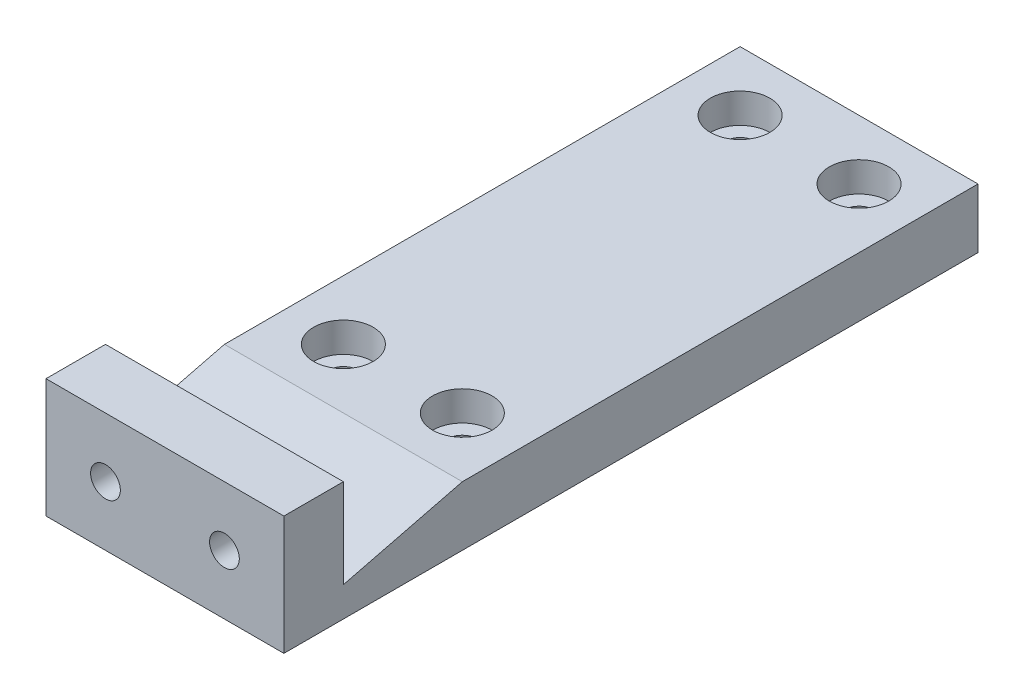
from build123d import *

# Parameters (mm, degrees)
SKETCH1_W               = 40
SKETCH1_H               = 116.7
BOSS_EXTRUDE1_DEPTH     = 10
SKETCH2_W               = 40
SKETCH2_H               = 10
BOSS_EXTRUDE2_DEPTH     = 10
CUT_EXTRUDE1_DEPTH      = 63.487778805
CUT_EXTRUDE1_DEPTH_BACK = 63.487778805
SKETCH3_R               = 2.5
SKETCH4_R               = 5
CUT_EXTRUDE2_DEPTH      = 5
CUT_EXTRUDE3_DEPTH      = 74.516817804
CUT_EXTRUDE3_DEPTH_BACK = 74.516817804
SKETCH6_R               = 2.5
CUT_EXTRUDE4_DEPTH      = 111.385189224
SKETCH7_R               = 5
CUT_EXTRUDE5_DEPTH      = 5


with BuildPart() as part:
    # Sketch1 → Boss-Extrude1 (new body)
    with BuildSketch(Plane(origin=(0, 0, 0), x_dir=(1, 0, 0), z_dir=(0, 1, 0))):
        Rectangle(SKETCH1_W, SKETCH1_H)
    extrude(amount=BOSS_EXTRUDE1_DEPTH)

    # Sketch2 → Boss-Extrude2 (add)
    with BuildSketch(Plane(origin=(0, 10, 0), x_dir=(1, 0, 0), z_dir=(0, 1, 0))):
        with Locations((0, -53.35)):
            Rectangle(SKETCH2_W, SKETCH2_H)
    extrude(amount=BOSS_EXTRUDE2_DEPTH)

    # Sketch3 → Cut-Extrude1 (cut, two sides: drawn at the far end of the back side and taken through both)
    with BuildSketch(Plane(origin=(0, 10, 0), x_dir=(1, 0, 0), z_dir=(0, 1, 0)).offset(-CUT_EXTRUDE1_DEPTH_BACK)):
        with Locations(Location((-10, 48.35, 0), (0, 0, 270))):
            Circle(SKETCH3_R)
        with Locations(Location((10, 48.35, 0), (0, 0, 270))):
            Circle(SKETCH3_R)
        with Locations(Location((10, -18.35, 0), (0, 0, 270))):
            Circle(SKETCH3_R)
        with Locations(Location((-10, -18.35, 0), (0, 0, 270))):
            Circle(SKETCH3_R)
    extrude(amount=CUT_EXTRUDE1_DEPTH + CUT_EXTRUDE1_DEPTH_BACK, mode=Mode.SUBTRACT)

    # Sketch4 → Cut-Extrude2 (cut)
    with BuildSketch(Plane(origin=(0, 10, 0), x_dir=(1, 0, 0), z_dir=(0, 1, 0))):
        with Locations(Location((10, 48.35, 0), (0, 0, 270))):
            Circle(SKETCH4_R)
        with Locations(Location((-10, 48.35, 0), (0, 0, 270))):
            Circle(SKETCH4_R)
        with Locations(Location((10, -18.35, 0), (0, 0, 270))):
            Circle(SKETCH4_R)
        with Locations(Location((-10, -18.35, 0), (0, 0, 270))):
            Circle(SKETCH4_R)
    extrude(amount=-CUT_EXTRUDE2_DEPTH, mode=Mode.SUBTRACT)

    # Sketch5 → Cut-Extrude3 (cut, two sides: drawn at the far end of the back side and taken through both)
    with BuildSketch(Plane.ZY.offset(20).offset(-CUT_EXTRUDE3_DEPTH_BACK)):
        Polygon((28.35, 10), (48.35, 5), (48.35, 10), align=None)
    extrude(amount=CUT_EXTRUDE3_DEPTH + CUT_EXTRUDE3_DEPTH_BACK, mode=Mode.SUBTRACT)

    # Sketch6 → Cut-Extrude4 (cut, through all)
    with BuildSketch(Plane(origin=(0, 0, 48.35), x_dir=(-1, 0, 0), z_dir=(0, 0, -1))):
        with Locations((-10, 10)):
            Circle(SKETCH6_R)
        with Locations((10, 10)):
            Circle(SKETCH6_R)
    extrude(amount=-CUT_EXTRUDE4_DEPTH, mode=Mode.SUBTRACT)

    # Sketch7 → Cut-Extrude5 (cut)
    with BuildSketch(Plane(origin=(0, 0, 48.35), x_dir=(-1, 0, 0), z_dir=(0, 0, -1))):
        with Locations((-10, 10)):
            Circle(SKETCH7_R)
        with Locations((10, 10)):
            Circle(SKETCH7_R)
    extrude(amount=-CUT_EXTRUDE5_DEPTH, mode=Mode.SUBTRACT)


solid = part.part
